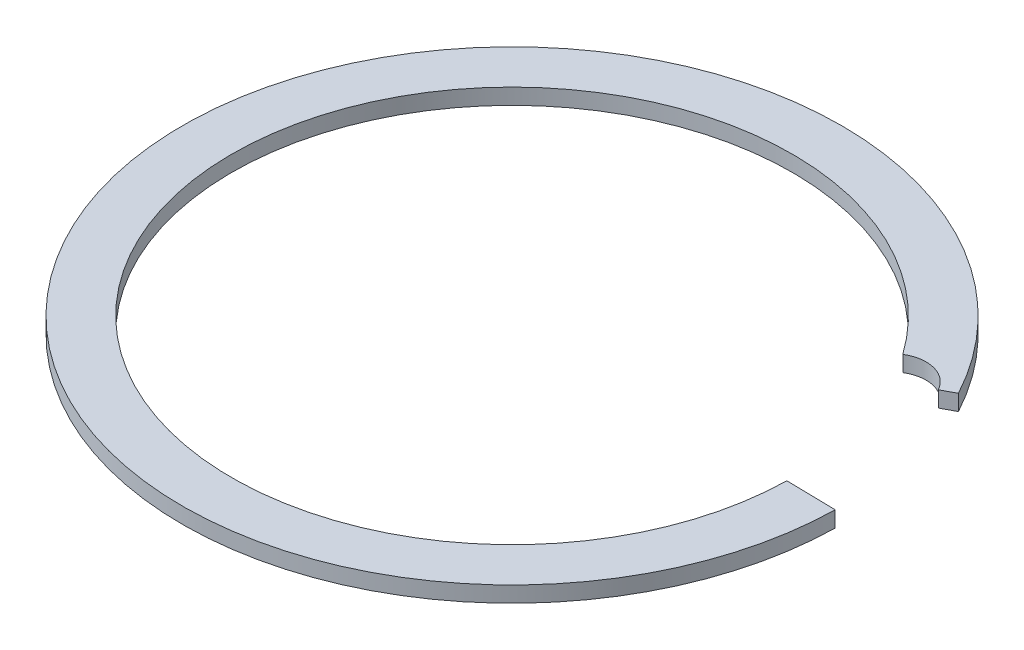
from build123d import *

# Parameters (mm, degrees)
EXTRUDE_THIN1_DEPTH = 0.53
SKETCH2_R           = 1.151524856
CUT_EXTRUDE1_DEPTH  = 16.607776908


with BuildPart() as part:
    # Sketch1 → Extrude-Thin1 (new body)
    with BuildSketch(Plane(origin=(0, 0, 0), x_dir=(1, 0, 0), z_dir=(0, 1, 0))):
        with BuildLine():
            ThreePointArc((9.712852175, 5.226987912), (-10.721135618, -2.591939635), (11.027949059, -0.212695892))
            Line((11.027949059, -0.212695892), (9.378255864, -0.180878284))
            ThreePointArc((9.378255864, -0.180878284), (-9.117339265, -2.204206144), (8.259886981, 4.445072223))
            Line((8.259886981, 4.445072223), (9.712852175, 5.226987912))
        make_face()
    extrude(amount=EXTRUDE_THIN1_DEPTH)

    # Sketch2 → Cut-Extrude1 (cut, through all)
    with BuildSketch(Plane(origin=(0, 0, 0), x_dir=(1, 0, 0), z_dir=(0, 1, 0))):
        with Locations((8.259886981, 4.445072223)):
            Circle(SKETCH2_R)
    extrude(amount=CUT_EXTRUDE1_DEPTH, mode=Mode.SUBTRACT)


solid = part.part
